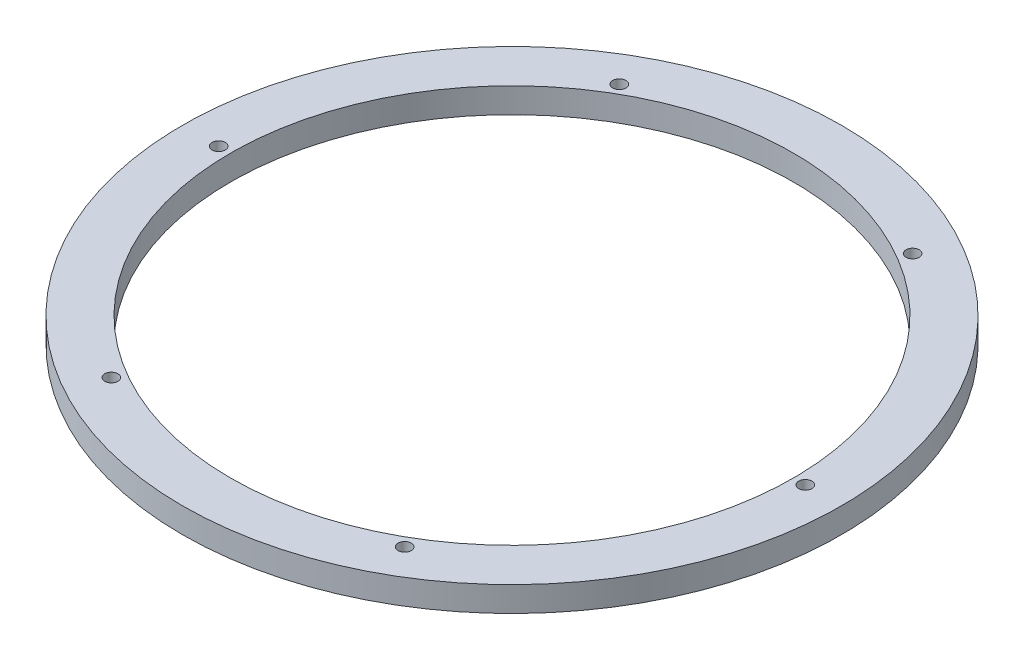
from build123d import *

# Parameters (mm, degrees)
SKETCH1_R           = 250
SKETCH1_R_2         = 213.5
BOSS_EXTRUDE1_DEPTH = 9.5
SKETCH2_R           = 5
CUT_EXTRUDE1_DEPTH  = 355.063553617


with BuildPart() as part:
    # Sketch1 → Boss-Extrude1 (new, symmetric)
    with BuildSketch(Plane(origin=(0, 0, 0), x_dir=(1, 0, 0), z_dir=(0, 1, 0))):
        with Locations(Location((0, 0, 0), (0, 0, 270))):
            Circle(SKETCH1_R)
        with Locations(Location((0, 0, 0), (0, 0, 270))):
            Circle(SKETCH1_R_2, mode=Mode.SUBTRACT)
    extrude(amount=BOSS_EXTRUDE1_DEPTH, both=True)

    # Sketch2 → Cut-Extrude1 (cut, through all)
    with BuildSketch(Plane(origin=(0, 9.5, 0), x_dir=(1, 0, 0), z_dir=(0, 1, 0))):
        with Locations(Location((-111.25, 192.690652342, 0), (0, 0, 270))):
            Circle(SKETCH2_R)
        with Locations(Location((-222.5, 0, 0), (0, 0, 270))):
            Circle(SKETCH2_R)
        with Locations(Location((222.5, 0, 0), (0, 0, 90))):
            Circle(SKETCH2_R)
        with Locations(Location((111.25, 192.690652342, 0), (0, 0, 90))):
            Circle(SKETCH2_R)
        with Locations(Location((111.25, -192.690652342, 0), (0, 0, 270))):
            Circle(SKETCH2_R)
        with Locations(Location((-111.25, -192.690652342, 0), (0, 0, 90))):
            Circle(SKETCH2_R)
    extrude(amount=-CUT_EXTRUDE1_DEPTH, mode=Mode.SUBTRACT)


solid = part.part
